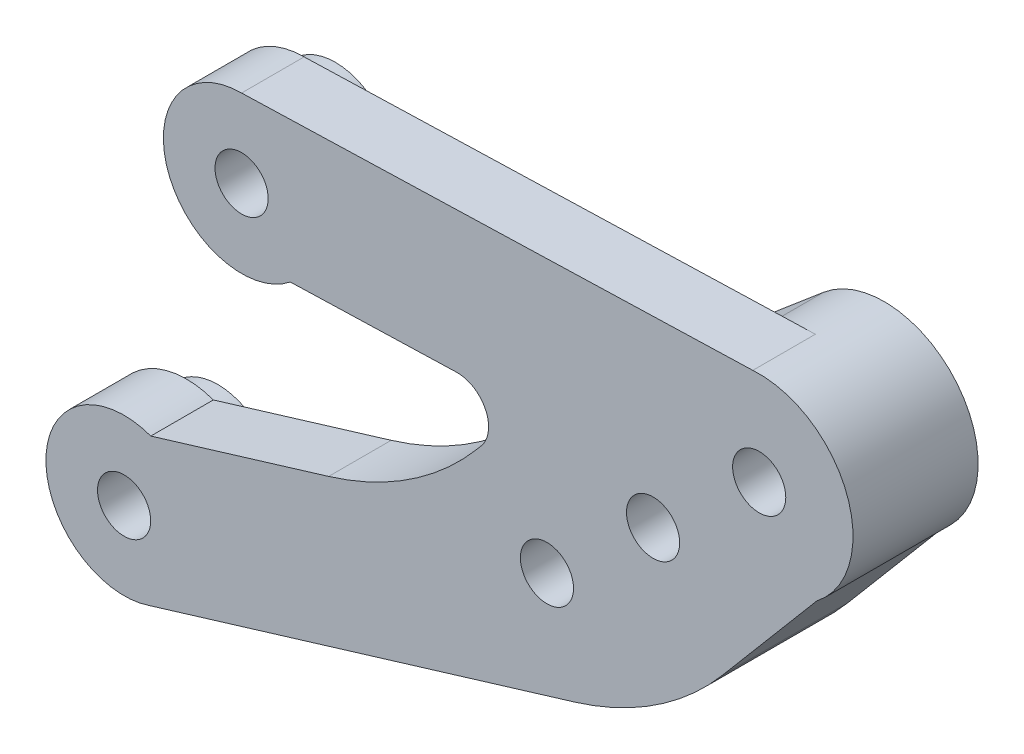
from build123d import *

# Parameters (mm, degrees)
BOSS_EXTRUDE1_DEPTH      = 2
BOSS_EXTRUDE1_DEPTH_BACK = 2
SKETCH2_R                = 1.7
FILLET1_R                = 20
BOSS_EXTRUDE4_START      = 4
SKETCH7_R                = 1.7
BOSS_EXTRUDE4_DEPTH      = 4
BOSS_EXTRUDE5_START      = 2
SKETCH8_R                = 3.7
SKETCH8_R_2              = 1.7
BOSS_EXTRUDE5_DEPTH      = 2
FILLET4_R                = 2
SKETCH9_R                = 1.7
CUT_EXTRUDE1_DEPTH       = 55.759144692


with BuildPart() as part:
    # Sketch2 → Boss-Extrude1 (new, two sides: drawn at the far end of the back side and taken through both)
    with BuildSketch(Plane.XY.offset(-BOSS_EXTRUDE1_DEPTH_BACK)):
        with BuildLine():
            Line((1.575752274, -4.745208612), (34.456924853, 5.232629629))
            Line((34.456924853, 5.232629629), (44.296635241, 16.864742156))
            ThreePointArc((44.296635241, 16.864742156), (46.218376178, 23.740514028), (40.203783054, 27.586810508))
            Line((40.203783054, 27.586810508), (7.512886707, 26.600773906))
            ThreePointArc((7.512886707, 26.600773906), (2.79322071, 19.950091357), (10.629154827, 17.690675057))
            Line((10.629154827, 17.690675057), (25.733767379, 18.146266751))
            Line((25.733767379, 18.146266751), (18.728666276, 9.86511608))
            Line((18.728666276, 9.86511608), (1.70658462, 4.699741369))
            ThreePointArc((1.70658462, 4.699741369), (-4.999520368, 0.069253832), (1.575752274, -4.745208612))
        make_face()
        Circle(SKETCH2_R, mode=Mode.SUBTRACT)
        with Locations((40.612886707, 21.600773906)):
            Circle(SKETCH2_R, mode=Mode.SUBTRACT)
        with Locations((7.512886707, 21.600773906)):
            Circle(SKETCH2_R, mode=Mode.SUBTRACT)
    extrude(amount=BOSS_EXTRUDE1_DEPTH + BOSS_EXTRUDE1_DEPTH_BACK)

    # Fillet1
    fillet1_edges = [part.edges().sort_by_distance(p)[0] for p in [
        (34.456924853, 5.232629629, 0),
        (18.728666276, 9.86511608, 0),
    ]]
    fillet(fillet1_edges, radius=FILLET1_R)

    # Sketch7 → Boss-Extrude4 (add)
    with BuildSketch(Plane(origin=(0, 0, -2), x_dir=(-1, 0, 0), z_dir=(0, 0, -1)).offset(BOSS_EXTRUDE4_START)):
        with BuildLine():
            Line((-36.733417778, 26.177860406), (-21.683989193, 13.422192867))
            ThreePointArc((-21.683989193, 13.422192867), (-21.70362245, 5.922427438), (-28.807655282, 3.518350802))
            ThreePointArc((-28.807655282, 3.518350802), (-33.988212002, 5.945467438), (-38.269694349, 9.739933408))
            Line((-38.269694349, 9.739933408), (-44.296635241, 16.864742156))
            ThreePointArc((-44.296635241, 16.864742156), (-45.270474012, 25.383217626), (-36.733417778, 26.177860406))
        make_face()
        with Locations(Location((-40.612886707, 21.600773906, 0), (0, 0, 180))):
            Circle(SKETCH7_R, mode=Mode.SUBTRACT)
    extrude(amount=-BOSS_EXTRUDE4_DEPTH)

    # Sketch8 → Boss-Extrude5 (add)
    # profile 1 of 2: a face of its own
    with BuildSketch(Plane(origin=(0, 0, -2), x_dir=(-1, 0, 0), z_dir=(0, 0, -1)).offset(BOSS_EXTRUDE5_START)):
        with Locations(Location((-7.512886707, 21.600773906, 0), (0, 0, 180))):
            Circle(SKETCH8_R)
        with Locations(Location((-7.512886707, 21.600773906, 0), (0, 0, 180))):
            Circle(SKETCH8_R_2, mode=Mode.SUBTRACT)
    # profile 2 of 2: a face of its own
    with BuildSketch(Plane(origin=(0, 0, -2), x_dir=(-1, 0, 0), z_dir=(0, 0, -1)).offset(BOSS_EXTRUDE5_START)):
        with Locations(Location((0, 0, 0), (0, 0, 180))):
            Circle(SKETCH8_R)
        with Locations(Location((0, 0, 0), (0, 0, 180))):
            Circle(SKETCH8_R_2, mode=Mode.SUBTRACT)
    extrude(amount=-BOSS_EXTRUDE5_DEPTH)

    # Fillet4
    fillet4_edges = [part.edges().sort_by_distance(p)[0] for p in [
        (25.733767379, 18.146266751, 0),
    ]]
    fillet(fillet4_edges, radius=FILLET4_R)

    # Sketch9 → Cut-Extrude1 (cut, through all)
    with BuildSketch(Plane(origin=(0, 0, -6), x_dir=(-1, 0, 0), z_dir=(0, 0, -1))):
        with Locations((-33.826808077, 15.688994408)):
            Circle(SKETCH9_R)
        with Locations((-27.040729447, 9.777214911)):
            Circle(SKETCH9_R)
    extrude(amount=-CUT_EXTRUDE1_DEPTH, mode=Mode.SUBTRACT)


solid = part.part
